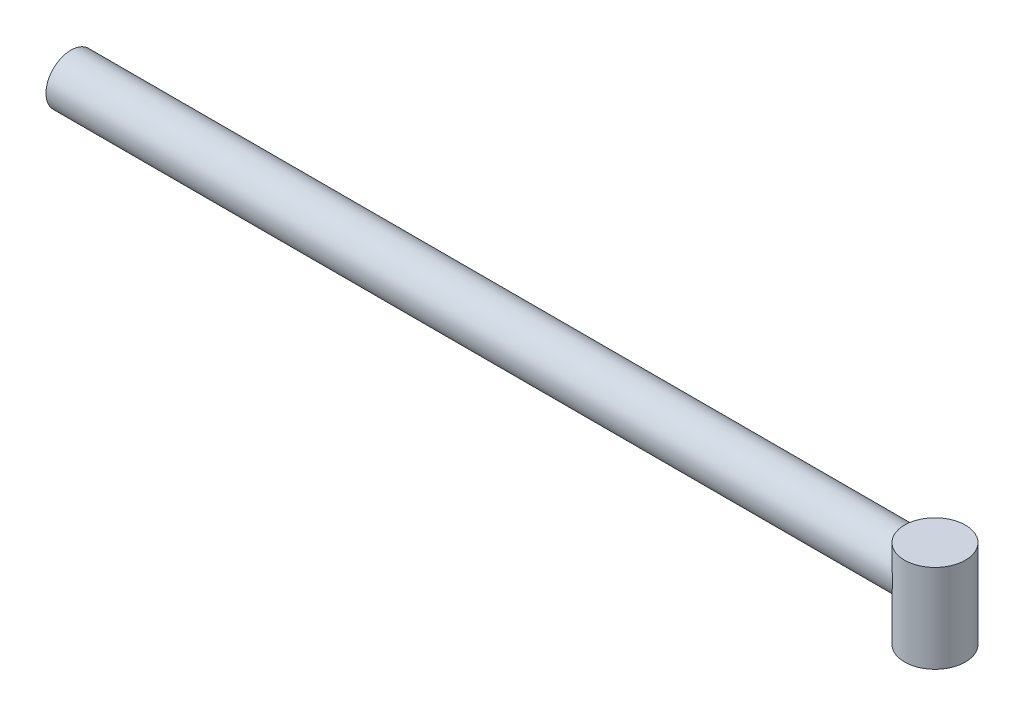
from build123d import *

# Parameters (mm, degrees)
BASE_START    = 36.5
BASE_SKETCH_R = 5
BASE_DEPTH    = 14.5
WHIP_START    = -6.4
WHIP_SKETCH_R = 4.1
WHIP_DEPTH    = 142


with BuildPart() as part:
    # Base Sketch → Base (new body)
    with BuildSketch(Plane(origin=(0, 0, 0), x_dir=(1, 0, 0), z_dir=(0, 1, 0)).offset(BASE_START)):
        with Locations((-6.4, 65)):
            Circle(BASE_SKETCH_R)
    extrude(amount=BASE_DEPTH)

    # Whip Sketch → Whip (add)
    with BuildSketch(Plane(origin=(0, 0, 0), x_dir=(0, 0, -1), z_dir=(1, 0, 0)).offset(WHIP_START)):
        with Locations((65, 46)):
            Circle(WHIP_SKETCH_R)
    extrude(amount=-WHIP_DEPTH)


solid = part.part
